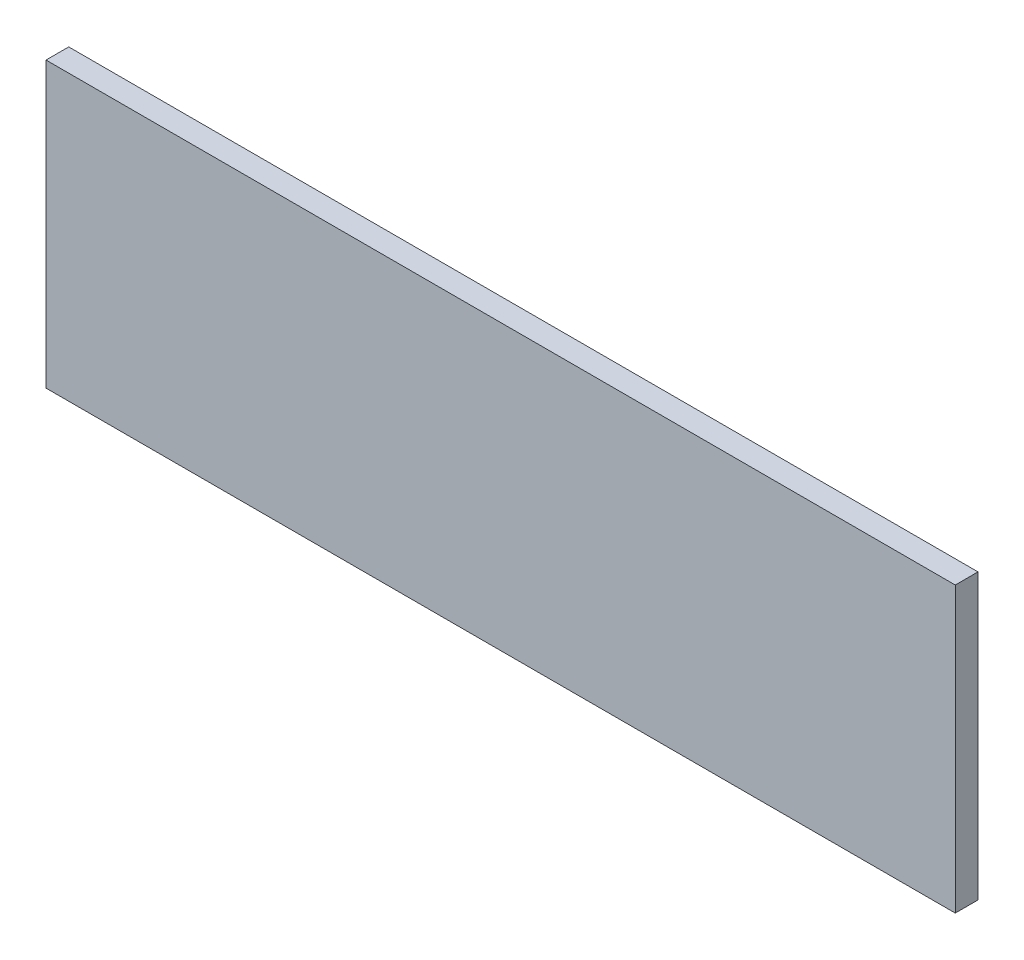
from build123d import *

# Parameters (mm, degrees)
ESQUISSE1_W        = 80
ESQUISSE1_H        = 25
BOSS_EXTRU_1_DEPTH = 2


with BuildPart() as part:
    # Esquisse1 → Boss.-Extru.1 (new body)
    with BuildSketch(Plane.XY):
        Rectangle(ESQUISSE1_W, ESQUISSE1_H)
    extrude(amount=BOSS_EXTRU_1_DEPTH)


solid = part.part
